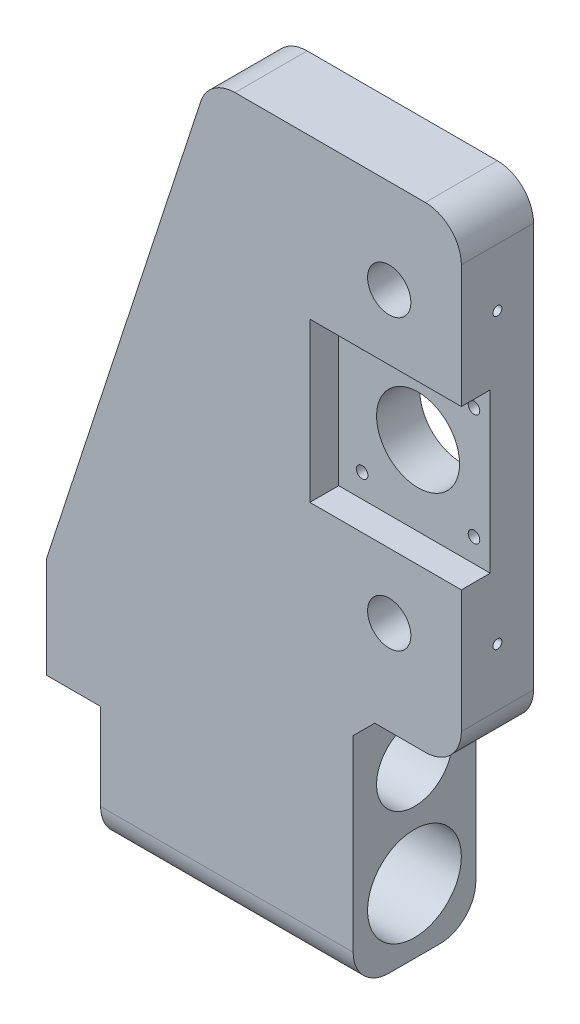
from build123d import *

# Parameters (mm, degrees)
BOSS_EXTRUDE2_DEPTH   = 34
SKETCH3_W             = 180.49084133
SKETCH3_H             = 138
CUT_EXTRUDE1_DEPTH    = 14
SKETCH4_R             = 11.5
SKETCH4_R_2           = 1.6
SKETCH4_R_3           = 6
CUT_EXTRUDE3_DEPTH    = 227.1769219
SKETCH5_W             = 42
SKETCH5_H             = 44
CUT_EXTRUDE4_DEPTH    = 8
M3_TAPPED_HOLE1_D     = 2.5
M3_TAPPED_HOLE1_DEPTH = 20
M3_TAPPED_HOLE1_TIP   = 0.751075774
SKETCH9_R             = 10.5
SKETCH9_R_2           = 7
CUT_EXTRUDE6_DEPTH    = 220.956813959
SKETCH10_R            = 11.5
CUT_EXTRUDE7_DEPTH    = 6
SKETCH11_R            = 13
CUT_EXTRUDE8_DEPTH    = 34
CHAMFER1_SIZE         = 6
FILLET1_R             = 10
SKETCH12_R            = 1.5
CUT_EXTRUDE9_DEPTH    = 30
SKETCH13_R            = 2.75
CUT_EXTRUDE10_DEPTH   = 3.5


with BuildPart() as part:
    # Sketch1 → Boss-Extrude2 (new body)
    with BuildSketch(Plane.XY):
        with BuildLine():
            Line((0, 0), (70, 0))
            Line((70, 0), (70, 62))
            Line((70, 62), (76, 68))
            Line((76, 68), (90, 68))
            ThreePointArc((90, 68), (97.071067812, 70.928932188), (100, 78))
            Line((100, 78), (100, 190))
            ThreePointArc((100, 190), (97.071067812, 197.071067812), (90, 200))
            Line((90, 200), (37.257365568, 200))
            ThreePointArc((37.257365568, 200), (31.383783185, 198.093270661), (27.750067173, 193.100205998))
            Line((27.750067173, 193.100205998), (-15, 62))
            Line((-15, 62), (-15, 34))
            Line((-15, 34), (0, 34))
            Line((0, 34), (0, 0))
        make_face()
    extrude(amount=BOSS_EXTRUDE2_DEPTH)

    # Sketch3 → Cut-Extrude1 (cut)
    with BuildSketch(Plane(origin=(0, 0, 0), x_dir=(-1, 0, 0), z_dir=(0, 0, -1))):
        with Locations((-9.754579335, 131)):
            Rectangle(SKETCH3_W, SKETCH3_H)
    extrude(amount=-CUT_EXTRUDE1_DEPTH, mode=Mode.SUBTRACT)

    # Sketch4 → Cut-Extrude3 (cut, through all)
    with BuildSketch(Plane.XY.offset(34)):
        with Locations((80, 134)):
            Circle(SKETCH4_R)
        with Locations((95.5, 149.5)):
            Circle(SKETCH4_R_2)
        with Locations((95.5, 118.5)):
            Circle(SKETCH4_R_2)
        with Locations((64.5, 118.5)):
            Circle(SKETCH4_R_2)
        with Locations((64.5, 149.5)):
            Circle(SKETCH4_R_2)
        with Locations((80, 174)):
            Circle(SKETCH4_R_3)
        with Locations((80, 94)):
            Circle(SKETCH4_R_3)
    extrude(amount=-CUT_EXTRUDE3_DEPTH, mode=Mode.SUBTRACT)

    # Sketch5 → Cut-Extrude4 (cut)
    with BuildSketch(Plane.XY.offset(34)):
        with Locations((79, 134)):
            Rectangle(SKETCH5_W, SKETCH5_H)
    extrude(amount=-CUT_EXTRUDE4_DEPTH, mode=Mode.SUBTRACT)

    # M3 Tapped Hole1
    with Locations(Plane(origin=(100, 0, 0), x_dir=(0, 0, -1), z_dir=(1, 0, 0))):
        with Locations((-24, 174), (-24, 94)):
            Hole(M3_TAPPED_HOLE1_D / 2, depth=M3_TAPPED_HOLE1_DEPTH)
            with Locations((0, 0, -(M3_TAPPED_HOLE1_DEPTH + M3_TAPPED_HOLE1_TIP / 2))):  # 118° drill point
                Cone(0, M3_TAPPED_HOLE1_D / 2, M3_TAPPED_HOLE1_TIP, mode=Mode.SUBTRACT)

    # Sketch9 → Cut-Extrude6 (cut, through all)
    with BuildSketch(Plane(origin=(70, 0, 0), x_dir=(0, 0, -1), z_dir=(1, 0, 0))):
        with Locations((-17, 47)):
            Circle(SKETCH9_R)
        with Locations((-17, 18)):
            Circle(SKETCH9_R_2)
    extrude(amount=-CUT_EXTRUDE6_DEPTH, mode=Mode.SUBTRACT)

    # Sketch10 → Cut-Extrude7 (cut)
    with BuildSketch(Plane.ZY):
        with Locations(Location((17, 18, 0), (0, 0, 270))):
            Circle(SKETCH10_R)
    extrude(amount=-CUT_EXTRUDE7_DEPTH, mode=Mode.SUBTRACT)

    # Sketch11 → Cut-Extrude8 (cut)
    with BuildSketch(Plane(origin=(70, 0, 0), x_dir=(0, 0, -1), z_dir=(1, 0, 0))):
        with Locations((-17, 18)):
            Circle(SKETCH11_R)
    extrude(amount=-CUT_EXTRUDE8_DEPTH, mode=Mode.SUBTRACT)

    # Chamfer1
    chamfer1_edges = [part.edges().sort_by_distance(p)[0] for p in [
        (27.5, 62, 0),
        (27.5, 62, 14),
    ]]
    chamfer(chamfer1_edges, length=CHAMFER1_SIZE)

    # Fillet1
    fillet1_edges = [part.edges().sort_by_distance(p)[0] for p in [
        (35, 0, 0),
        (35, 0, 34),
    ]]
    fillet(fillet1_edges, radius=FILLET1_R)

    # Sketch12 → Cut-Extrude9 (cut)
    with BuildSketch(Plane.ZY.offset(-6)):
        with Locations((17, 26)):
            Circle(SKETCH12_R)
        with Locations((25, 18)):
            Circle(SKETCH12_R)
        with Locations((17, 10)):
            Circle(SKETCH12_R)
        with Locations((9, 18)):
            Circle(SKETCH12_R)
    extrude(amount=-CUT_EXTRUDE9_DEPTH, mode=Mode.SUBTRACT)

    # Sketch13 → Cut-Extrude10 (cut)
    with BuildSketch(Plane(origin=(0, 0, 14), x_dir=(-1, 0, 0), z_dir=(0, 0, -1))):
        with Locations((-95.5, 149.5)):
            Circle(SKETCH13_R)
        with Locations((-64.5, 149.5)):
            Circle(SKETCH13_R)
        with Locations((-64.5, 118.5)):
            Circle(SKETCH13_R)
        with Locations((-95.5, 118.5)):
            Circle(SKETCH13_R)
    extrude(amount=-CUT_EXTRUDE10_DEPTH, mode=Mode.SUBTRACT)


solid = part.part
